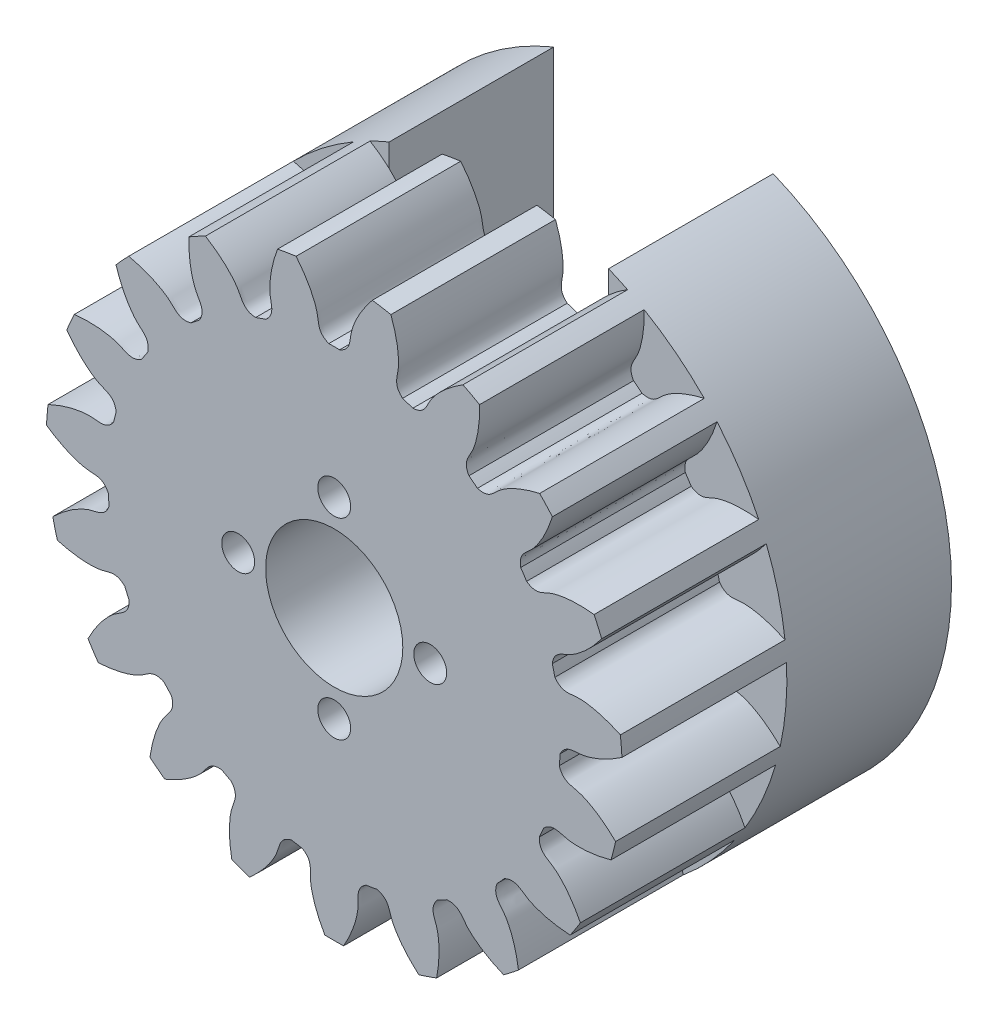
from build123d import *

# Parameters (mm, degrees)
SKETCH_1_R               = 52.5
EXTRUDE_1_DEPTH          = 30
CUT_EXTRUDE_1_DEPTH      = 81.07808689
PATTERN_CIRCULAR_1_COUNT = 19
SKETCH_5_R               = 12.5
CUT_EXTRUDE_2_DEPTH      = 30
SKETCH_6_R               = 3
CUT_EXTRUDE_3_DEPTH      = 30
PATTERN_CIRCULAR_2_COUNT = 4
EXTRUDE_START            = 30
SKETCH_7_R               = 52.5
EXTRUDE_2_DEPTH          = 30
SKETCH_8_W               = 40
SKETCH_8_H               = 127.719816956
CUT_EXTRUDE_4_DEPTH      = 30


with BuildPart() as part:
    # 草图1 → 凸台-拉伸1 (new body)
    with BuildSketch(Plane.XY):
        Circle(SKETCH_1_R)
    extrude(amount=EXTRUDE_1_DEPTH)

    # 草图2 → 切除-拉伸1 (cut, through all)
    with BuildSketch(Plane.XY):
        with BuildLine():
            ThreePointArc((0.982927767, 41.238287465), (0, 41.25), (-0.982927767, 41.238287465))
            add(Edge.make_bspline(
                [(-0.982927767, 41.238287465), (-3.016645087, 42.059116693), (-2.795720748, 43.611898631), (-3.126813959, 45.100812555), (-3.162648663, 45.248288383), (-3.205994934, 45.412279739), (-3.257504817, 45.592542574), (-3.317851096, 45.788807743), (-3.387690276, 46.00078751), (-3.467673421, 46.228173777), (-3.558442125, 46.470638905), (-3.660629044, 46.727835751), (-3.77485706, 46.999397966), (-3.901738858, 47.28494023), (-4.041876391, 47.58405852), (-4.195860386, 47.896330387), (-4.364269845, 48.221315247), (-4.547671562, 48.558554685), (-4.746619635, 48.907572763), (-4.961655003, 49.267876357), (-5.193304972, 49.638955485), (-5.442082766, 50.020283667), (-5.708487074, 50.41131828), (-5.993001615, 50.811500933), (-6.296094709, 51.220257853), (-6.61821885, 51.637000278), (-6.959810305, 52.061124862), (-7.321288706, 52.492014094), (-7.703056664, 52.929036721), (-8.105499387, 53.371548186), (-8.528984312, 53.818891072), (-8.973860746, 54.270395559), (-9.440459516, 54.725379886), (-9.929092641, 55.183150828), (-10.440052998, 55.643004173), (-10.973614018, 56.104225216), (-11.53002938, 56.566089255), (-12.10953272, 57.027862097), (-12.712337388, 57.488800571), (-13.338636033, 57.948153058), (-14.214993243, 58.564342158), (-14.893532148, 59.011322525), (-15.356569357, 59.30352126)],
                knots=[0, 0, 0, 0, 0.181988078, 0.187668717, 0.194106774, 0.201302249, 0.209255143, 0.217965455, 0.227433186, 0.237658335, 0.248640902, 0.260380888, 0.272878293, 0.286133115, 0.300145357, 0.314915016, 0.330442095, 0.346726591, 0.363768506, 0.38156784, 0.400124592, 0.419438762, 0.439510351, 0.460339358, 0.481925784, 0.504269628, 0.52737089, 0.551229571, 0.575845671, 0.601219189, 0.627350125, 0.65423848, 0.681884253, 0.710287445, 0.739448055, 0.769366084, 0.800041531, 0.831474396, 0.86366468, 0.896612382, 0.930317503, 1, 1, 1, 1], degree=3))
            ThreePointArc((-15.356569357, 59.30352126), (0, 61.259545022), (15.356569357, 59.30352126))
            add(Edge.make_bspline(
                [(0.982927767, 41.238287465), (3.016645087, 42.059116693), (2.795720748, 43.611898631), (3.126813959, 45.100812555), (3.162648663, 45.248288383), (3.205994934, 45.412279739), (3.257504817, 45.592542574), (3.317851096, 45.788807743), (3.387690276, 46.00078751), (3.467673421, 46.228173777), (3.558442125, 46.470638905), (3.660629044, 46.727835751), (3.77485706, 46.999397966), (3.901738858, 47.28494023), (4.041876391, 47.58405852), (4.195860386, 47.896330387), (4.364269845, 48.221315247), (4.547671562, 48.558554685), (4.746619635, 48.907572763), (4.961655003, 49.267876357), (5.193304972, 49.638955485), (5.442082766, 50.020283667), (5.708487074, 50.41131828), (5.993001615, 50.811500933), (6.296094709, 51.220257853), (6.61821885, 51.637000278), (6.959810305, 52.061124862), (7.321288706, 52.492014094), (7.703056664, 52.929036721), (8.105499387, 53.371548186), (8.528984312, 53.818891072), (8.973860746, 54.270395559), (9.440459516, 54.725379886), (9.929092641, 55.183150828), (10.440052998, 55.643004173), (10.973614018, 56.104225216), (11.53002938, 56.566089255), (12.10953272, 57.027862097), (12.712337388, 57.488800571), (13.338636033, 57.948153058), (14.214993243, 58.564342158), (14.893532148, 59.011322525), (15.356569357, 59.30352126)],
                knots=[0, 0, 0, 0, 0.181988078, 0.187668717, 0.194106774, 0.201302249, 0.209255143, 0.217965455, 0.227433186, 0.237658335, 0.248640902, 0.260380888, 0.272878293, 0.286133115, 0.300145357, 0.314915016, 0.330442095, 0.346726591, 0.363768506, 0.38156784, 0.400124592, 0.419438762, 0.439510351, 0.460339358, 0.481925784, 0.504269628, 0.52737089, 0.551229571, 0.575845671, 0.601219189, 0.627350125, 0.65423848, 0.681884253, 0.710287445, 0.739448055, 0.769366084, 0.800041531, 0.831474396, 0.86366468, 0.896612382, 0.930317503, 1, 1, 1, 1], degree=3))
        make_face()
    cut_extrude_1 = extrude(amount=CUT_EXTRUDE_1_DEPTH, mode=Mode.SUBTRACT)

    # 阵列(圆周)1: 切除-拉伸1 ×19 about axis
    pattern_circular_1_axis = Axis((0, 0, -1.5), (0, 0, 1))
    for i in range(1, PATTERN_CIRCULAR_1_COUNT):
        add(cut_extrude_1.rotate(pattern_circular_1_axis, i * 360 / PATTERN_CIRCULAR_1_COUNT), mode=Mode.SUBTRACT)

    # 草图5 → 切除-拉伸2 (cut)
    with BuildSketch(Plane.XY.offset(30)):
        Circle(SKETCH_5_R)
    extrude(amount=-CUT_EXTRUDE_2_DEPTH, mode=Mode.SUBTRACT)

    # 草图6 → 切除-拉伸3 (cut)
    with BuildSketch(Plane.XY.offset(30)):
        with Locations((-17.5, 0)):
            Circle(SKETCH_6_R)
    cut_extrude_3 = extrude(amount=-CUT_EXTRUDE_3_DEPTH, mode=Mode.SUBTRACT)

    # 阵列(圆周)2: 切除-拉伸3 ×4 about axis
    pattern_circular_2_axis = Axis((0, 0, 0), (0, 0, 1))
    for i in range(1, PATTERN_CIRCULAR_2_COUNT):
        add(cut_extrude_3.rotate(pattern_circular_2_axis, i * 360 / PATTERN_CIRCULAR_2_COUNT), mode=Mode.SUBTRACT)

    # 草图7 → 凸台-拉伸2 (add)
    with BuildSketch(Plane(origin=(0, 0, 0), x_dir=(-1, 0, 0), z_dir=(0, 0, -1)).offset(EXTRUDE_START)):
        Circle(SKETCH_7_R)
    extrude(amount=-EXTRUDE_2_DEPTH)

    # 草图8 → 切除-拉伸4 (cut)
    with BuildSketch(Plane(origin=(0, 0, -30), x_dir=(-1, 0, 0), z_dir=(0, 0, -1))):
        Rectangle(SKETCH_8_W, SKETCH_8_H)
    extrude(amount=-CUT_EXTRUDE_4_DEPTH, mode=Mode.SUBTRACT)


solid = part.part
